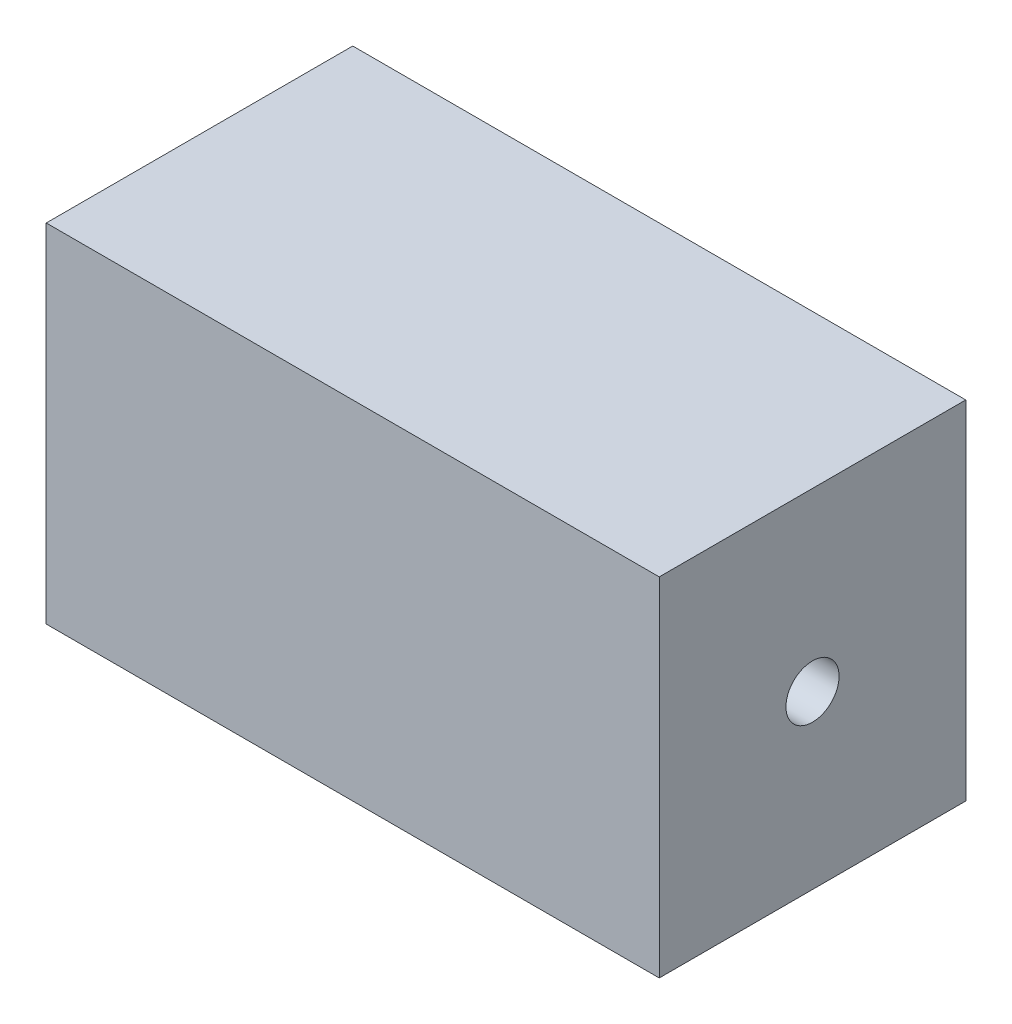
from build123d import *

# Parameters (mm, degrees)
SKETCH1_W           = 190.5
SKETCH1_H           = 95.25
BOSS_EXTRUDE1_DEPTH = 107.95
SKETCH2_R           = 8.255
CUT_EXTRUDE1_DEPTH  = 33.147


with BuildPart() as part:
    # Sketch1 → Boss-Extrude1 (new body)
    with BuildSketch(Plane(origin=(0, 0, 0), x_dir=(1, 0, 0), z_dir=(0, 1, 0))):
        with Locations((95.25, 47.625)):
            Rectangle(SKETCH1_W, SKETCH1_H)
    extrude(amount=BOSS_EXTRUDE1_DEPTH)

    # Sketch2 → Cut-Extrude1 (cut, symmetric)
    with BuildSketch(Plane(origin=(190.5, 0, 0), x_dir=(0, 0, -1), z_dir=(1, 0, 0))):
        with Locations((47.625, 53.286871915)):
            Circle(SKETCH2_R)
    extrude(amount=CUT_EXTRUDE1_DEPTH, both=True, mode=Mode.SUBTRACT)


solid = part.part
